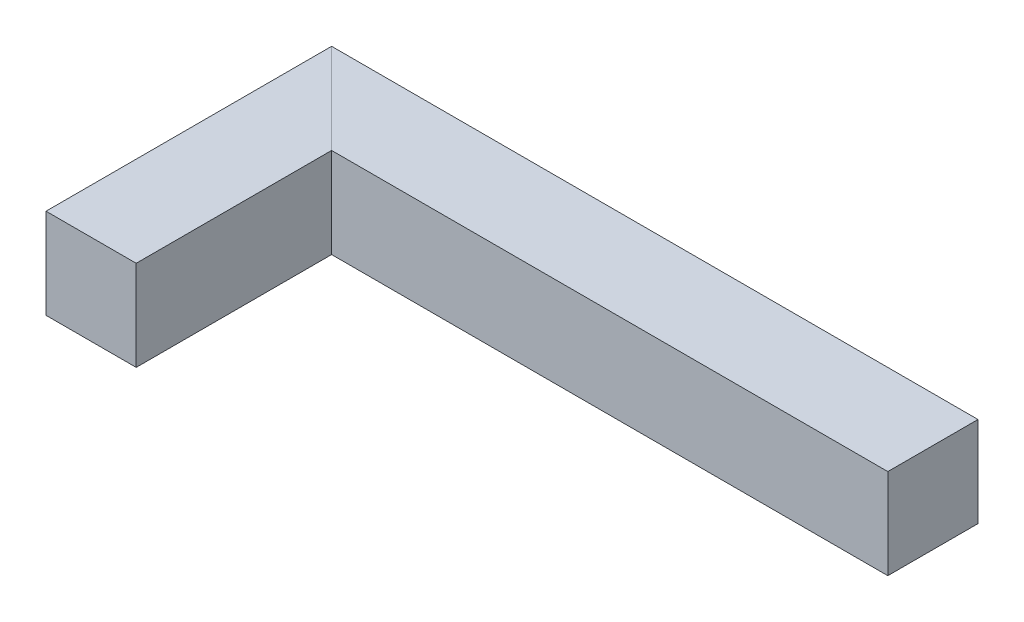
from build123d import *

# Parameters (mm, degrees)
SKETCH1_W = 30
SKETCH1_H = 30


with BuildPart() as part:
    # Sweep1: sweep along a path in Sketch2
    with BuildLine(Plane(origin=(0, 0, 0), x_dir=(1, 0, 0), z_dir=(0, 1, 0))) as sweep1_path:
        Line((0, 0), (0, 80))
        Line((0, 80), (200, 80))
    # Sketch1 → Sweep1 (sweep)
    with BuildSketch(Plane.XY):
        Rectangle(SKETCH1_W, SKETCH1_H)
    sweep(path=sweep1_path.line, transition=Transition.RIGHT)


solid = part.part
